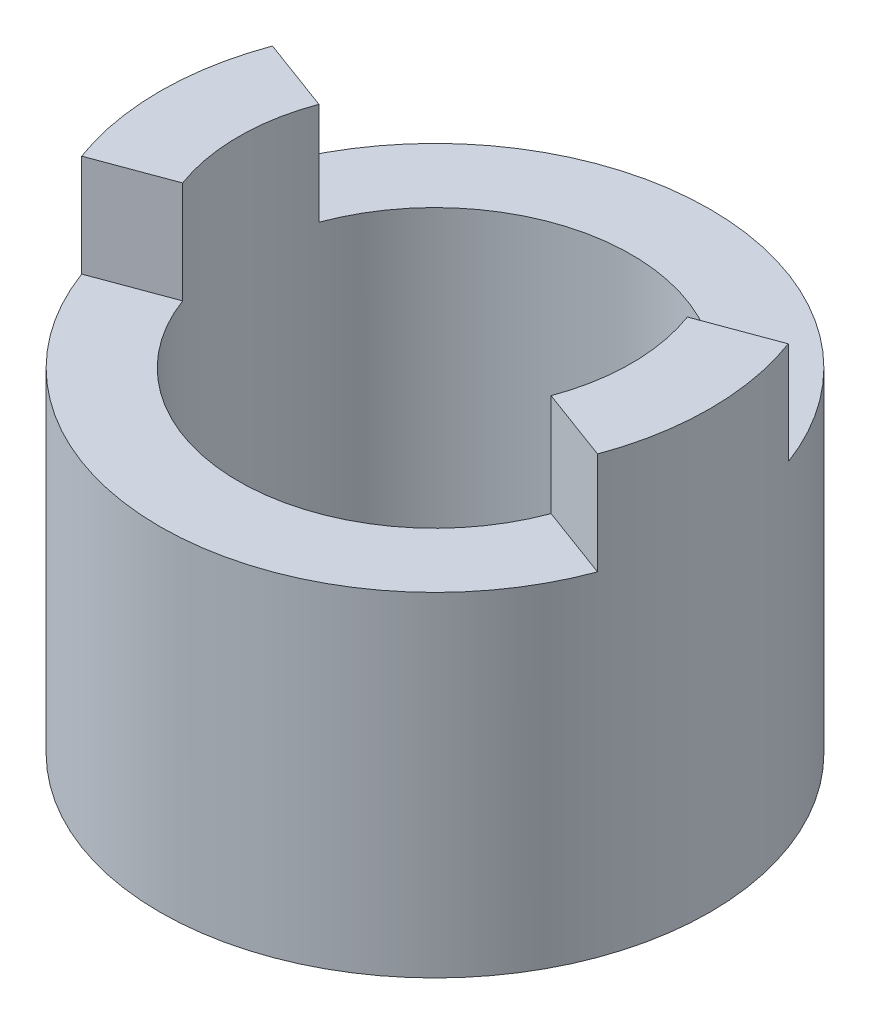
from build123d import *
from build123d.topology import SkipClean

# Parameters (mm, degrees)
SKETCH1_R           = 3.5
SKETCH1_R_2         = 2.5
BOSS_EXTRUDE1_DEPTH = 4.25
BOSS_EXTRUDE2_DEPTH = 1.3


with BuildPart() as part:
    # Sketch1 → Boss-Extrude1 (new body)
    with BuildSketch(Plane(origin=(0, 0, 0), x_dir=(1, 0, 0), z_dir=(0, 1, 0))):
        with Locations(Location((0, 0, 0), (0, 0, 270))):
            Circle(SKETCH1_R)
        with Locations(Location((0, 0, 0), (0, 0, 270))):
            Circle(SKETCH1_R_2, mode=Mode.SUBTRACT)
    extrude(amount=BOSS_EXTRUDE1_DEPTH)

    # Sketch2 → Boss-Extrude2 (add)
    with SkipClean():  # the faces are left unmerged after this step: merging them gives an invalid solid
        with BuildSketch(Plane(origin=(0, 4.25, 0), x_dir=(1, 0, 0), z_dir=(0, 1, 0))):
            with BuildLine():
                Line((2.344759123, 0.867239676), (3.282662772, 1.214135546))
                ThreePointArc((3.282662772, 1.214135546), (3.5, 0), (3.282662772, -1.214135546))
                Line((3.282662772, -1.214135546), (2.344759123, -0.867239676))
                ThreePointArc((2.344759123, -0.867239676), (2.5, 0), (2.344759123, 0.867239676))
            make_face()
            with BuildLine():
                Line((-2.344759123, -0.867239676), (-3.282662772, -1.214135546))
                ThreePointArc((-3.282662772, -1.214135546), (-3.5, 0), (-3.282662772, 1.214135546))
                Line((-3.282662772, 1.214135546), (-2.344759123, 0.867239676))
                ThreePointArc((-2.344759123, 0.867239676), (-2.5, 0), (-2.344759123, -0.867239676))
            make_face()
        extrude(amount=BOSS_EXTRUDE2_DEPTH)


solid = part.part
